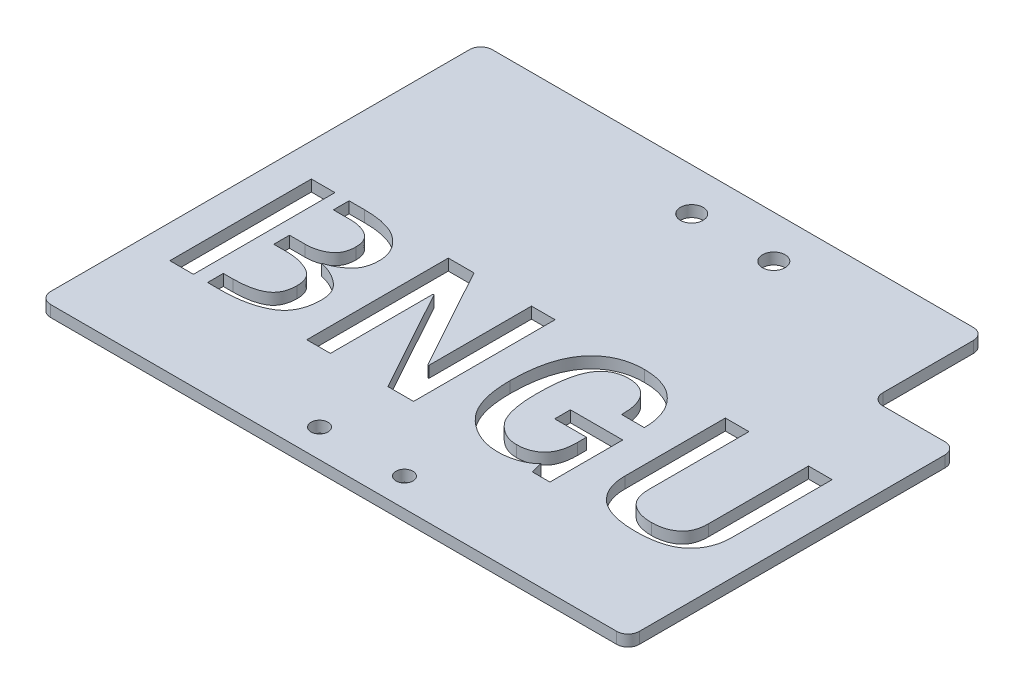
from build123d import *

# Parameters (mm, degrees)
EXTRUDE_1_DEPTH     = 2
FILLET_1_R          = 2
LOGO_DEPTH          = 2
SKETCH_3_W          = 2.5
SKETCH_3_H          = 25
EXTRUDE_2_DEPTH     = 2
SKETCH_4_R          = 2
SKETCH_4_R_2        = 1.5
CUT_EXTRUDE_3_DEPTH = 2


with BuildPart() as part:
    # 草图1 → 凸台-拉伸1 (new body)
    with BuildSketch(Plane(origin=(0, 0, 0), x_dir=(1, 0, 0), z_dir=(0, 1, 0))):
        Polygon((0, 0), (0, 78), (89, 78), (89, 58), (104, 58), (104, 0), align=None)
    extrude(amount=EXTRUDE_1_DEPTH)

    # 圆角1
    fillet_1_edges = [part.edges().sort_by_distance(p)[0] for p in [
        (0, 1, 0),
        (0, 1, -78),
        (89, 1, -78),
        (89, 1, -58),
        (104, 1, -58),
        (104, 1, 0),
    ]]
    fillet(fillet_1_edges, radius=FILLET_1_R)

    # 草图2 → logo (cut)
    # profile 1 of 4: a face of its own
    with BuildSketch(Plane(origin=(0, 2, 0), x_dir=(1, 0, 0), z_dir=(0, 1, 0))):
        with BuildLine():
            add(Edge.make_bspline(
                [(25.226120858, 24.687134503), (25.218918149, 24.347305571), (25.205024624, 23.691799094), (25.067711071, 22.749188256), (24.844971319, 21.887044307), (24.520575792, 21.109092326), (24.116208821, 20.407401373), (23.609568579, 19.793168198), (23.012613163, 19.26107857), (22.322396799, 18.821609494), (21.568969033, 18.447024277), (20.764156113, 18.122185635), (19.910076783, 17.845886905), (19.004205022, 17.61764369), (18.046484617, 17.44812605), (17.039822333, 17.32358873), (15.982487856, 17.24683815), (15.259462104, 17.236358844), (14.889322071, 17.230994152)],
                knots=[0, 0, 0, 0, 1.11954951, 2.159533475, 3.13222658, 4.047102644, 4.929761252, 5.792114018, 6.660235367, 7.554666331, 8.480618687, 9.430778714, 10.412924277, 11.437459573, 12.507622459, 13.616784515, 14.779955684, 16, 16, 16, 16], degree=3))
            Line((14.889322071, 17.230994152), (5.819579814, 17.230994152))
            Line((5.819579814, 17.230994152), (5.819579814, 42.230994152))
            Line((5.819579814, 42.230994152), (15.252111761, 42.230994152))
            add(Edge.make_bspline(
                [(15.252111761, 42.230994152), (15.618769149, 42.227343518), (16.328071434, 42.22028133), (17.356455804, 42.122166822), (18.317189933, 41.983411322), (19.205443239, 41.770500544), (20.024185195, 41.507323032), (20.773208938, 41.181795644), (21.450624425, 40.792920936), (22.05480624, 40.346396853), (22.582892218, 39.858309969), (23.046811356, 39.34853593), (23.441745921, 38.814857129), (23.760809203, 38.25585791), (24.014544636, 37.675790985), (24.195015821, 37.070737648), (24.297357603, 36.440662913), (24.313650467, 36.013383329), (24.321854018, 35.798245614)],
                knots=[0, 0, 0, 0, 1.413668594, 2.73475565, 3.981243613, 5.154813589, 6.253384945, 7.294606527, 8.298864947, 9.259614885, 10.185923231, 11.068202689, 11.914795542, 12.741167123, 13.545605976, 14.351790145, 15.170116909, 16, 16, 16, 16], degree=3))
            add(Edge.make_bspline(
                [(24.321854018, 35.798245614), (24.318929373, 35.586798205), (24.313234501, 35.175067478), (24.233948179, 34.581119949), (24.116631882, 34.027521597), (23.951094697, 33.517535226), (23.730807773, 33.051330502), (23.46738632, 32.626458378), (23.147674441, 32.247884393), (22.667530319, 31.811467767), (22.022226874, 31.349499578), (21.233985996, 30.875310066), (20.431426421, 30.496577117), (19.878649948, 30.326637336), (19.605588044, 30.242690058)],
                knots=[0, 0, 0, 0, 0.958772294, 1.866922913, 2.713493585, 3.524123282, 4.293489854, 5.047890201, 5.786113318, 6.533725977, 7.986680182, 9.378593345, 10.705070991, 12, 12, 12, 12], degree=3))
            add(Edge.make_bspline(
                [(19.605588044, 30.242690058), (19.962278513, 30.160250293), (20.669890727, 29.996704053), (21.676542033, 29.58238454), (22.633332888, 29.069277369), (23.36949366, 28.537304657), (23.912979713, 28.063390787), (24.263330688, 27.666869356), (24.561816629, 27.24429958), (24.810474418, 26.7918499), (24.991289551, 26.305068666), (25.129133348, 25.79258247), (25.211137703, 25.249290848), (25.221062306, 24.876927436), (25.226120858, 24.687134503)],
                knots=[0, 0, 0, 0, 1.529969424, 3.03519479, 4.539453037, 6.065743904, 6.825479159, 7.553216724, 8.274218205, 8.987460551, 9.707194475, 10.441994778, 11.205887661, 12, 12, 12, 12], degree=3))
        make_face()
        with BuildLine():
            add(Edge.make_bspline(
                [(20.147065194, 35.798245614), (20.143386832, 35.951964688), (20.136254364, 36.250031152), (20.067655287, 36.679422853), (19.969619571, 37.080178342), (19.813997831, 37.443732101), (19.62527713, 37.779451315), (19.387238869, 38.079568337), (19.11225975, 38.353446336), (18.675996782, 38.662011829), (18.068238098, 38.983579471), (17.259843484, 39.262772761), (16.370378932, 39.424299975), (15.750941619, 39.443363708), (15.43079922, 39.453216374)],
                knots=[0, 0, 0, 0, 0.818869559, 1.587815668, 2.313706959, 3.012493189, 3.689265386, 4.361093564, 5.048388454, 5.750941397, 7.201766865, 8.699080735, 10.293993293, 12, 12, 12, 12], degree=3))
            Line((15.43079922, 39.453216374), (9.988953866, 39.453216374))
            Line((9.988953866, 39.453216374), (9.988953866, 31.704678363))
            Line((9.988953866, 31.704678363), (15.252111761, 31.704678363))
            add(Edge.make_bspline(
                [(15.252111761, 31.704678363), (15.574329778, 31.7151634), (16.200568201, 31.73554132), (17.104289791, 31.921326779), (17.943001302, 32.211393667), (18.583261589, 32.559053906), (19.039440476, 32.901351057), (19.338617963, 33.198720106), (19.587613142, 33.537843864), (19.795887433, 33.913638275), (19.952851573, 34.331930117), (20.063593961, 34.786496947), (20.13764603, 35.279643038), (20.143847306, 35.621074389), (20.147065194, 35.798245614)],
                knots=[0, 0, 0, 0, 1.60050649, 3.110622645, 4.56673179, 6.000657466, 6.711457408, 7.396817003, 8.08965687, 8.79659374, 9.526623066, 10.303681172, 11.119767751, 12, 12, 12, 12], degree=3))
        make_face(mode=Mode.SUBTRACT)
        with BuildLine():
            add(Edge.make_bspline(
                [(20.872644574, 24.687134503), (20.868951314, 24.875344358), (20.861799844, 25.239785799), (20.76403417, 25.762461296), (20.62296728, 26.246765021), (20.406367659, 26.681599749), (20.142376022, 27.08049696), (19.802664362, 27.420715638), (19.415858926, 27.731313156), (18.809840914, 28.068265918), (17.989922778, 28.411868145), (16.946769621, 28.711405697), (15.845161576, 28.894508184), (15.090380864, 28.915955911), (14.70521984, 28.926900585)],
                knots=[0, 0, 0, 0, 0.802377247, 1.553688673, 2.263041879, 2.948899454, 3.620052748, 4.295835499, 4.99268811, 5.731565817, 7.247370686, 8.779076859, 10.356378168, 12, 12, 12, 12], degree=3))
            Line((14.70521984, 28.926900585), (9.988953866, 28.926900585))
            Line((9.988953866, 28.926900585), (9.988953866, 20.00877193))
            Line((9.988953866, 20.00877193), (14.16374269, 20.00877193))
            add(Edge.make_bspline(
                [(14.16374269, 20.00877193), (14.42732464, 20.011816851), (14.940522275, 20.017745353), (15.685295279, 20.06552867), (16.382158425, 20.149229451), (17.031581165, 20.250518517), (17.630071918, 20.402180672), (18.185587246, 20.569186481), (18.688657923, 20.783809407), (19.150484975, 21.019547808), (19.561215335, 21.300112745), (19.91430611, 21.637794987), (20.211255873, 22.024064637), (20.46121728, 22.457316548), (20.641824372, 22.947337952), (20.776290172, 23.482691518), (20.85884543, 24.069133094), (20.867923093, 24.475680669), (20.872644574, 24.687134503)],
                knots=[0, 0, 0, 0, 1.347742629, 2.624073187, 3.813490315, 4.936266786, 5.981609865, 6.968224518, 7.898952823, 8.77411914, 9.616403772, 10.432389384, 11.261269181, 12.100362274, 12.979655268, 13.922024951, 14.919202036, 16, 16, 16, 16], degree=3))
        make_face(mode=Mode.SUBTRACT)
    # profile 2 of 4: a face of its own
    with BuildSketch(Plane(origin=(0, 2, 0), x_dir=(1, 0, 0), z_dir=(0, 1, 0))):
        Polygon((48.880008664, 17.230994152), (44.347844921, 17.230994152), (34.368421053, 35.359649123), (34.189733593, 35.359649123), (34.189733593, 17.230994152), (30.014944769, 17.230994152), (30.014944769, 42.230994152), (34.552523284, 42.230994152), (44.52653238, 24.102339181), (44.710634611, 24.102339181), (44.710634611, 42.230994152), (48.880008664, 42.230994152), align=None)
    # profile 3 of 4: a face of its own
    with BuildSketch(Plane(origin=(0, 2, 0), x_dir=(1, 0, 0), z_dir=(0, 1, 0))):
        with BuildLine():
            Line((73.25947585, 16.938596491), (70.178470869, 16.938596491))
            Line((70.178470869, 16.938596491), (69.631578947, 18.985380117))
            add(Edge.make_bspline(
                [(69.631578947, 18.985380117), (69.499314169, 18.839127542), (69.222752261, 18.533317549), (68.685307153, 18.164336751), (68.068656762, 17.806747639), (67.353189199, 17.508500914), (66.575506009, 17.254299528), (65.750652473, 17.070851289), (64.891213185, 16.961004782), (64.307376825, 16.946140814), (64.011046134, 16.938596491)],
                knots=[0, 0, 0, 0, 0.767442906, 1.604701388, 2.529469646, 3.549167086, 4.623319042, 5.720931757, 6.843241165, 8, 8, 8, 8], degree=3))
            add(Edge.make_bspline(
                [(64.011046134, 16.938596491), (63.696452695, 16.946190237), (63.073306692, 16.961231914), (62.154256662, 17.103701217), (61.260194064, 17.322392442), (60.396700704, 17.643755387), (59.550469099, 18.036050286), (58.73794885, 18.534432744), (57.951359762, 19.119468489), (57.18398172, 19.777352191), (56.483124191, 20.547257735), (55.87254068, 21.428594874), (55.356231216, 22.418522131), (54.937070121, 23.514799929), (54.612524369, 24.718022109), (54.384467491, 26.02649816), (54.24249169, 27.441941882), (54.22484054, 28.42117148), (54.215724496, 28.926900585)],
                knots=[0, 0, 0, 0, 0.865077006, 1.713542665, 2.553109544, 3.39367472, 4.244578837, 5.115920224, 6.010903404, 6.940175798, 7.89297282, 8.867019675, 9.882244854, 10.957664174, 12.090191402, 13.306010942, 14.6086729, 16, 16, 16, 16], degree=3))
            add(Edge.make_bspline(
                [(54.215724496, 28.926900585), (54.224173602, 29.481224868), (54.240544018, 30.555246079), (54.362415284, 32.113099773), (54.578138514, 33.560204041), (54.874007333, 34.898345406), (55.249868493, 36.128850186), (55.715572785, 37.250823982), (56.266204624, 38.265598986), (56.911327842, 39.165195269), (57.626938767, 39.957215261), (58.404803149, 40.646316068), (59.248564857, 41.22453291), (60.151058462, 41.705804282), (61.121242803, 42.074451721), (62.151971182, 42.331913926), (63.24248891, 42.493306719), (63.990614624, 42.513201087), (64.373835824, 42.523391813)],
                knots=[0, 0, 0, 0, 1.382569107, 2.678772324, 3.894208237, 5.029031138, 6.094159622, 7.099134551, 8.054143245, 8.967374384, 9.853470589, 10.71150337, 11.553164139, 12.399004532, 13.256836511, 14.134717572, 15.044524526, 16, 16, 16, 16], degree=3))
            add(Edge.make_bspline(
                [(64.373835824, 42.523391813), (64.711741058, 42.516976482), (65.371717247, 42.504446445), (66.331965053, 42.381842694), (67.236918923, 42.188736114), (68.085956515, 41.917089916), (68.881960778, 41.572144424), (69.616484961, 41.140835748), (70.294983155, 40.633248498), (70.90889093, 40.04832266), (71.459360011, 39.404039956), (71.946392616, 38.714003418), (72.352959527, 37.974093171), (72.684478438, 37.187805471), (72.945023346, 36.357646847), (73.128474248, 35.480007858), (73.237277419, 34.557405321), (73.25197866, 33.92683502), (73.25947585, 33.605263158)],
                knots=[0, 0, 0, 0, 1.140714503, 2.227974994, 3.263401446, 4.261998282, 5.233739708, 6.187222325, 7.132072596, 8.089328008, 9.044737778, 9.990079519, 10.936815643, 11.89012287, 12.867602395, 13.870673145, 14.914107434, 16, 16, 16, 16], degree=3))
            Line((73.25947585, 33.605263158), (69.268789257, 33.605263158))
            add(Edge.make_bspline(
                [(69.268789257, 33.605263158), (69.264471329, 33.852666549), (69.256074597, 34.333772231), (69.196101441, 35.030006221), (69.101089345, 35.680325065), (68.960333918, 36.281324186), (68.782375062, 36.836078167), (68.567163592, 37.344263147), (68.305991191, 37.801429016), (68.005309021, 38.211074256), (67.671610249, 38.575513858), (67.297329228, 38.885991682), (66.895750342, 39.153934276), (66.457595041, 39.372472345), (65.98449345, 39.540086576), (65.477369956, 39.656196246), (64.937764335, 39.737368417), (64.565479816, 39.742811866), (64.373835824, 39.745614035)],
                knots=[0, 0, 0, 0, 1.328024506, 2.582503541, 3.748667833, 4.853311098, 5.892075822, 6.873013094, 7.810442157, 8.711615928, 9.596122737, 10.455869631, 11.3158349, 12.182488376, 13.0773894, 14.003381365, 14.972184054, 16, 16, 16, 16], degree=3))
            add(Edge.make_bspline(
                [(64.373835824, 39.745614035), (64.138719256, 39.738798206), (63.681813351, 39.725552892), (63.019189855, 39.60936874), (62.403338717, 39.418245326), (61.82709286, 39.160153045), (61.302584187, 38.812399712), (60.824585022, 38.39117928), (60.385233107, 37.899820731), (60.000372177, 37.322047991), (59.656194972, 36.660635852), (59.36568034, 35.898448354), (59.120209263, 35.035505274), (58.915151747, 34.069585323), (58.762736005, 33.00196308), (58.650596302, 31.832966559), (58.578952276, 30.56124853), (58.57253292, 29.677850055), (58.56920078, 29.219298246)],
                knots=[0, 0, 0, 0, 0.832114377, 1.617061594, 2.373166264, 3.111087094, 3.845011032, 4.592393477, 5.362046513, 6.172195451, 7.044130574, 7.997253869, 9.055197408, 10.218542587, 11.491261745, 12.871999735, 14.376327077, 16, 16, 16, 16], degree=3))
            add(Edge.make_bspline(
                [(58.56920078, 29.219298246), (58.573404523, 28.785942675), (58.581488502, 27.952581208), (58.670087586, 26.75611563), (58.805742202, 25.6628785), (59.004339078, 24.676157882), (59.256736341, 23.792782989), (59.563335264, 23.012002362), (59.927439675, 22.331335296), (60.365616397, 21.765811592), (60.827345986, 21.280012977), (61.313350816, 20.869800736), (61.806609166, 20.510008304), (62.325090544, 20.224799535), (62.855913203, 19.991345733), (63.408849747, 19.837841006), (63.974668213, 19.734159416), (64.358928297, 19.72233271), (64.552523284, 19.716374269)],
                knots=[0, 0, 0, 0, 1.64856264, 3.17025711, 4.562129254, 5.837585217, 6.9959998, 8.053196581, 9.024410688, 9.921325733, 10.766505245, 11.570239933, 12.338236354, 13.085314044, 13.817534768, 14.539180181, 15.264020896, 16, 16, 16, 16], degree=3))
            add(Edge.make_bspline(
                [(64.552523284, 19.716374269), (64.744044964, 19.720270332), (65.1174143, 19.727865662), (65.662721514, 19.7947114), (66.177848078, 19.901316364), (66.662526935, 20.05298514), (67.114734108, 20.248471483), (67.534829721, 20.487515748), (67.921561257, 20.773073899), (68.282328309, 21.096906635), (68.601405673, 21.472632614), (68.882235056, 21.89475103), (69.11262379, 22.367631884), (69.301276129, 22.887334505), (69.455602259, 23.451599155), (69.552043672, 24.065475016), (69.621108965, 24.725277166), (69.628002844, 25.181479886), (69.631578947, 25.418128655)],
                knots=[0, 0, 0, 0, 1.054224783, 2.055199205, 3.020047512, 3.947310121, 4.846450914, 5.727840112, 6.602479579, 7.488953058, 8.391219209, 9.309113937, 10.273603878, 11.279794564, 12.350197654, 13.489006214, 14.697457155, 16, 16, 16, 16], degree=3))
            Line((69.631578947, 25.418128655), (69.631578947, 27.026315789))
            Line((69.631578947, 27.026315789), (64.011046134, 27.026315789))
            Line((64.011046134, 27.026315789), (64.011046134, 29.804093567))
            Line((64.011046134, 29.804093567), (73.25947585, 29.804093567))
            Line((73.25947585, 29.804093567), (73.25947585, 16.938596491))
        make_face()
    # profile 4 of 4: a face of its own
    with BuildSketch(Plane(origin=(0, 2, 0), x_dir=(1, 0, 0), z_dir=(0, 1, 0))):
        with BuildLine():
            add(Edge.make_bspline(
                [(97.823045267, 24.540935673), (97.815161812, 24.255468839), (97.799791102, 23.698882), (97.697574369, 22.885756864), (97.519359768, 22.119956336), (97.267288904, 21.398278485), (96.950831501, 20.720167425), (96.555181113, 20.091484902), (96.091753672, 19.508943448), (95.559140882, 18.970144023), (94.950416002, 18.480955179), (94.24878004, 18.07440699), (93.47441125, 17.717258559), (92.613666738, 17.436057487), (91.674930336, 17.205818219), (90.650522213, 17.05577832), (89.547678769, 16.955205958), (88.784232908, 16.944247777), (88.39051332, 16.938596491)],
                knots=[0, 0, 0, 0, 0.992858757, 1.935818987, 2.844902527, 3.7224424, 4.590182096, 5.441946876, 6.299820383, 7.174323582, 8.072394129, 9.006915973, 9.987312075, 11.033515111, 12.151114754, 13.345292208, 14.630930479, 16, 16, 16, 16], degree=3))
            add(Edge.make_bspline(
                [(88.39051332, 16.938596491), (87.994981632, 16.944127955), (87.231515126, 16.954804943), (86.128724295, 17.056141475), (85.106127634, 17.205862972), (84.167245868, 17.435811458), (83.305440545, 17.718626867), (82.527959696, 18.072924608), (81.825261602, 18.48111581), (81.216484832, 18.970117292), (80.683744194, 19.508898624), (80.220863233, 20.091685361), (79.823571365, 20.718760749), (79.515110806, 21.399763425), (79.261211807, 22.119743197), (79.08358034, 22.885816848), (78.981201024, 23.698865835), (78.965853128, 24.255463359), (78.957981373, 24.540935673)],
                knots=[0, 0, 0, 0, 1.375080839, 2.654220117, 3.848168282, 4.965553339, 6.011555498, 6.997473881, 7.93181629, 8.829714402, 9.704049692, 10.561758482, 11.413359717, 12.278272332, 13.155643712, 14.064552702, 15.007331878, 16, 16, 16, 16], degree=3))
            Line((78.957981373, 24.540935673), (78.957981373, 42.230994152))
            Line((78.957981373, 42.230994152), (83.127355426, 42.230994152))
            Line((83.127355426, 42.230994152), (83.127355426, 24.540935673))
            add(Edge.make_bspline(
                [(83.127355426, 24.540935673), (83.130659214, 24.340343966), (83.137050998, 23.952262618), (83.210445975, 23.390721319), (83.321859664, 22.869941309), (83.478489477, 22.387459474), (83.684663801, 21.947677529), (83.934834328, 21.548696611), (84.230966443, 21.190974863), (84.574698906, 20.878510985), (84.952156768, 20.601756124), (85.36506425, 20.371494551), (85.795516663, 20.160610655), (86.262480149, 20.001773265), (86.753458101, 19.867755845), (87.276963988, 19.788660261), (87.82386877, 19.721506609), (88.198955157, 19.718109293), (88.39051332, 19.716374269)],
                knots=[0, 0, 0, 0, 1.182759217, 2.288264056, 3.334700062, 4.321346854, 5.274082089, 6.192888273, 7.09274025, 8.004609144, 8.926864405, 9.847458331, 10.790563991, 11.750413713, 12.752568674, 13.788932877, 14.870798911, 16, 16, 16, 16], degree=3))
            add(Edge.make_bspline(
                [(88.39051332, 19.716374269), (88.582076743, 19.718090182), (88.957173429, 19.721450079), (89.504004482, 19.788871616), (90.026046176, 19.866752097), (90.516119273, 20.003828847), (90.984049038, 20.159457687), (91.415027786, 20.370059913), (91.824265306, 20.603452515), (92.201033603, 20.87830619), (92.544613753, 21.191028631), (92.840786167, 21.548681967), (93.090945644, 21.947681645), (93.297123077, 22.387458312), (93.453752007, 22.869941646), (93.565165952, 23.390721222), (93.638560856, 23.952262645), (93.64495265, 24.340343976), (93.648256444, 24.540935673)],
                knots=[0, 0, 0, 0, 1.129869646, 2.212376211, 3.249354004, 4.241803426, 5.212275367, 6.155939403, 7.067850344, 7.990651636, 8.903060413, 9.803445157, 10.722795331, 11.676094643, 12.663325591, 13.710381151, 14.816540517, 16, 16, 16, 16], degree=3))
            Line((93.648256444, 24.540935673), (93.648256444, 42.230994152))
            Line((93.648256444, 42.230994152), (97.823045267, 42.230994152))
            Line((97.823045267, 42.230994152), (97.823045267, 24.540935673))
        make_face()
    extrude(amount=-LOGO_DEPTH, mode=Mode.SUBTRACT)


with BuildPart() as logo_piece_1:
    # of the separate pieces the step leaves, piece 1, a body of its own (logo_pieces)
    add(part.part.solids().sort_by_distance((0, 0, -2))[0])



with BuildPart() as logo_piece_2:
    # of the separate pieces the step leaves, piece 2, a body of its own (logo_pieces)
    add(part.part.solids().sort_by_distance((20.872644574, 0, -24.687134503))[0])


with BuildPart() as logo_piece_3:
    # of the separate pieces the step leaves, piece 3, a body of its own (logo_pieces)
    add(part.part.solids().sort_by_distance((20.147065194, 0, -35.798245614))[0])


with BuildPart() as logo_piece_1_1:
    add(logo_piece_1.part)

    add(logo_piece_2.part)  # 凸台-拉伸2 merges logo piece 2

    add(logo_piece_3.part)  # 凸台-拉伸2 merges logo piece 3
    # 草图3 → 凸台-拉伸2 (add)
    with BuildSketch(Plane(origin=(0, 2, 0), x_dir=(1, 0, 0), z_dir=(0, 1, 0))):
        with Locations((11.238953866, 29.730994152)):
            Rectangle(SKETCH_3_W, SKETCH_3_H)
    extrude(amount=-EXTRUDE_2_DEPTH)

    # 草图4 → 切除-拉伸3 (cut)
    with BuildSketch(Plane(origin=(0, 2, 0), x_dir=(1, 0, 0), z_dir=(0, 1, 0))):
        with Locations(Location((44.75, 70.5, 0), (0, 0, 270))):
            Circle(SKETCH_4_R)
        with Locations(Location((59.25, 70.5, 0), (0, 0, 270))):
            Circle(SKETCH_4_R)
        with Locations(Location((44.5, 5, 0), (0, 0, 270))):
            Circle(SKETCH_4_R_2)
        with Locations(Location((59.5, 5, 0), (0, 0, 270))):
            Circle(SKETCH_4_R_2)
    extrude(amount=-CUT_EXTRUDE_3_DEPTH, mode=Mode.SUBTRACT)


solid = logo_piece_1_1.part
